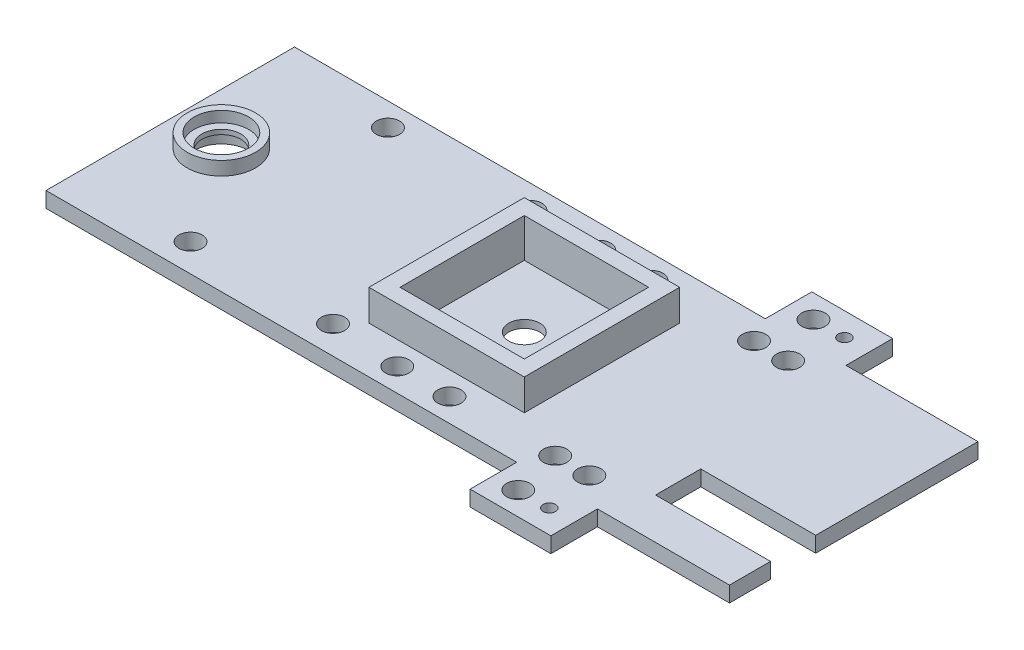
from build123d import *

# Parameters (mm, degrees)
SKETCH1_W            = 279.4
SKETCH1_H            = 101.6
BOSS_EXTRUDE1_DEPTH  = 6.35
SKETCH2_R            = 13.97
BOSS_EXTRUDE3_DEPTH  = 5.55625
SKETCH9_R            = 11.1125
CUT_EXTRUDE4_DEPTH   = 4.445
CUT_EXTRUDE5_START   = -5.55625
SKETCH10_R           = 11.1125
CUT_EXTRUDE5_DEPTH   = 5.55625
SKETCH11_R           = 7.9375
CUT_EXTRUDE6_DEPTH   = 285.078633923
SKETCH12_R           = 6.35
CUT_EXTRUDE7_DEPTH   = 285.051619429
SKETCH22_W           = 63.5
SKETCH22_H           = 63.5
BOSS_EXTRUDE7_DEPTH  = 12.7
SKETCH25_W           = 50.8
SKETCH25_H           = 50.8
CUT_EXTRUDE11_DEPTH  = 15.875
SKETCH32_R           = 4.7625
CUT_EXTRUDE12_DEPTH  = 6.35
SKETCH38_W           = 46.99
SKETCH38_H           = 18.470251096
CUT_EXTRUDE13_DEPTH  = 6.35
SKETCH60_R           = 4.7625
CUT_EXTRUDE23_DEPTH  = 6.35
SKETCH64_R           = 4.7625
CUT_EXTRUDE24_DEPTH  = 285.264471927
SKETCH69_W           = 33.02
SKETCH69_H           = 6.35
BOSS_EXTRUDE10_DEPTH = 19.05
SKETCH70_R           = 4.7625
SKETCH70_R_2         = 2.54
CUT_EXTRUDE26_DEPTH  = 6.35


with BuildPart() as part:
    # Sketch1 → Boss-Extrude1 (new body)
    with BuildSketch(Plane(origin=(0, 0, 0), x_dir=(1, 0, 0), z_dir=(0, 1, 0))):
        with Locations((-139.7, 0)):
            Rectangle(SKETCH1_W, SKETCH1_H)
    extrude(amount=BOSS_EXTRUDE1_DEPTH)

    # Sketch2 → Boss-Extrude3 (add)
    with BuildSketch(Plane(origin=(0, 6.35, 0), x_dir=(1, 0, 0), z_dir=(0, 1, 0))):
        with Locations(Location((-258.510557857, 0, 0), (0, 0, 90))):
            Circle(SKETCH2_R)
    extrude(amount=BOSS_EXTRUDE3_DEPTH)

    # Sketch9 → Cut-Extrude4 (cut)
    with BuildSketch(Plane(origin=(0, 11.90625, 0), x_dir=(1, 0, 0), z_dir=(0, 1, 0))):
        with Locations(Location((-258.510557857, 0, 0), (0, 0, 270))):
            Circle(SKETCH9_R)
    extrude(amount=-CUT_EXTRUDE4_DEPTH, mode=Mode.SUBTRACT)

    # Sketch10 → Cut-Extrude5 (cut)
    with BuildSketch(Plane(origin=(0, 0, 0), x_dir=(-1, 0, 0), z_dir=(0, -1, 0)).offset(CUT_EXTRUDE5_START)):
        with Locations(Location((258.510557857, 0, 0), (0, 0, 270))):
            Circle(SKETCH10_R)
    extrude(amount=CUT_EXTRUDE5_DEPTH, mode=Mode.SUBTRACT)

    # Sketch11 → Cut-Extrude6 (cut, through all)
    with BuildSketch(Plane(origin=(0, 7.46125, 0), x_dir=(1, 0, 0), z_dir=(0, 1, 0))):
        with Locations(Location((-258.510557857, 0, 0), (0, 0, 270))):
            Circle(SKETCH11_R)
    extrude(amount=-CUT_EXTRUDE6_DEPTH, mode=Mode.SUBTRACT)

    # Sketch12 → Cut-Extrude7 (cut, through all)
    with BuildSketch(Plane(origin=(0, 6.35, 0), x_dir=(1, 0, 0), z_dir=(0, 1, 0))):
        with Locations(Location((-134.666203771, 0, 0), (0, 0, 270))):
            Circle(SKETCH12_R)
    extrude(amount=-CUT_EXTRUDE7_DEPTH, mode=Mode.SUBTRACT)

    # Sketch22 → Boss-Extrude7 (add)
    with BuildSketch(Plane(origin=(0, 6.35, 0), x_dir=(1, 0, 0), z_dir=(0, 1, 0))):
        with Locations((-134.666203771, 0)):
            Rectangle(SKETCH22_W, SKETCH22_H)
    extrude(amount=BOSS_EXTRUDE7_DEPTH)

    # Sketch25 → Cut-Extrude11 (cut)
    with BuildSketch(Plane(origin=(0, 19.05, 0), x_dir=(1, 0, 0), z_dir=(0, 1, 0))):
        with Locations((-134.666203771, 0)):
            Rectangle(SKETCH25_W, SKETCH25_H)
    extrude(amount=-CUT_EXTRUDE11_DEPTH, mode=Mode.SUBTRACT)

    # Sketch32 → Cut-Extrude12 (cut)
    with BuildSketch(Plane(origin=(0, 6.35, 0), x_dir=(1, 0, 0), z_dir=(0, 1, 0))):
        with Locations(Location((-67.44195898, -40.64, 0), (0, 0, 270))):
            Circle(SKETCH32_R)
        with Locations(Location((-81.41195898, -40.64, 0), (0, 0, 270))):
            Circle(SKETCH32_R)
        with Locations(Location((-67.44195898, 40.64, 0), (0, 0, 270))):
            Circle(SKETCH32_R)
        with Locations(Location((-81.41195898, 40.64, 0), (0, 0, 270))):
            Circle(SKETCH32_R)
    extrude(amount=-CUT_EXTRUDE12_DEPTH, mode=Mode.SUBTRACT)

    # Sketch38 → Cut-Extrude13 (cut)
    with BuildSketch(Plane(origin=(0, 6.35, 0), x_dir=(1, 0, 0), z_dir=(0, 1, 0))):
        with Locations((-23.495, -24.777709652)):
            Rectangle(SKETCH38_W, SKETCH38_H)
    extrude(amount=-CUT_EXTRUDE13_DEPTH, mode=Mode.SUBTRACT)

    # Sketch60 → Cut-Extrude23 (cut)
    with BuildSketch(Plane(origin=(0, 6.35, 0), x_dir=(1, 0, 0), z_dir=(0, 1, 0))):
        with Locations(Location((-231.7492444, 41.324145444, 0), (0, 0, 270))):
            Circle(SKETCH60_R)
        with Locations(Location((-231.7492444, -39.369341378, 0), (0, 0, 270))):
            Circle(SKETCH60_R)
        with Locations(Location((-173.509244294, -39.369341378, 0), (0, 0, 270))):
            Circle(SKETCH60_R)
        with Locations(Location((-173.509244294, 41.324145444, 0), (0, 0, 270))):
            Circle(SKETCH60_R)
    extrude(amount=-CUT_EXTRUDE23_DEPTH, mode=Mode.SUBTRACT)

    # Sketch64 → Cut-Extrude24 (cut, through all)
    with BuildSketch(Plane(origin=(0, 6.35, 0), x_dir=(1, 0, 0), z_dir=(0, 1, 0))):
        with Locations(Location((-145.334203771, -41.275, 0), (0, 0, 270))):
            Circle(SKETCH64_R)
        with Locations(Location((-123.998203771, -41.275, 0), (0, 0, 270))):
            Circle(SKETCH64_R)
    cut_extrude24 = extrude(amount=-CUT_EXTRUDE24_DEPTH, mode=Mode.SUBTRACT)

    # Mirror1: Cut-Extrude24 across plane
    add(cut_extrude24.mirror(Plane.XY), mode=Mode.SUBTRACT)

    # Sketch69 → Boss-Extrude10 (add)
    with BuildSketch(Plane.XY.offset(50.8)):
        with Locations((-70.465355554, 3.175)):
            Rectangle(SKETCH69_W, SKETCH69_H)
    boss_extrude10 = extrude(amount=BOSS_EXTRUDE10_DEPTH)

    # Sketch70 → Cut-Extrude26 (cut)
    with BuildSketch(Plane(origin=(0, 6.35, 0), x_dir=(1, 0, 0), z_dir=(0, 1, 0))):
        with Locations(Location((-76.815355554, -60.325, 0), (0, 0, 270))):
            Circle(SKETCH70_R)
        with Locations(Location((-64.115355554, -60.325, 0), (0, 0, 270))):
            Circle(SKETCH70_R_2)
    cut_extrude26 = extrude(amount=-CUT_EXTRUDE26_DEPTH, mode=Mode.SUBTRACT)

    # Mirror2: Boss-Extrude10, Cut-Extrude26 across plane
    add(boss_extrude10.mirror(Plane.XY))
    add(cut_extrude26.mirror(Plane.XY), mode=Mode.SUBTRACT)


solid = part.part
